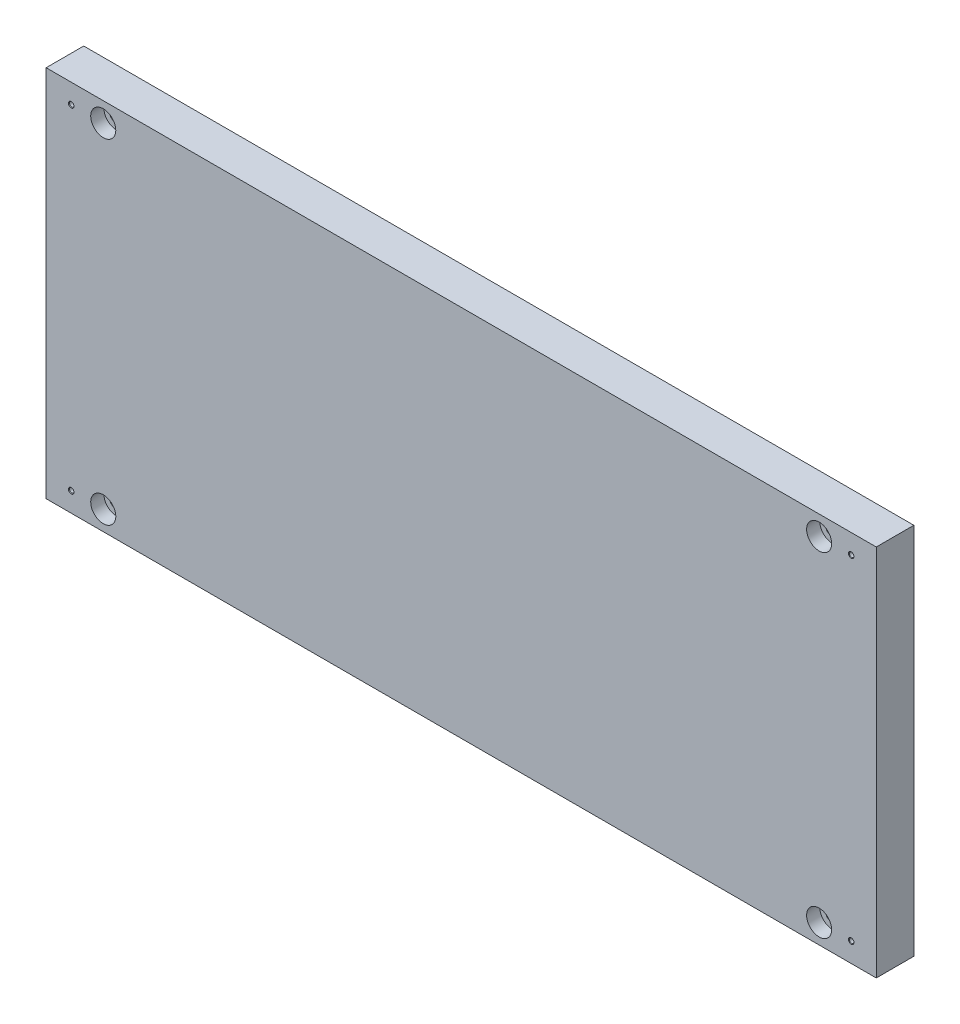
from build123d import *

# Parameters (mm, degrees)
SZKIC1_W                    = 596
SZKIC1_H                    = 268
DODANIE_WYCI_GNI_CIE1_DEPTH = 27
SZKIC2_W                    = 17.5
SZKIC2_H                    = 5
SZKIC3_W                    = 17.5
SZKIC3_H                    = 5
SZKIC4_W                    = 17.5
SZKIC4_H                    = 5
SZKIC5_W                    = 17.5
SZKIC5_H                    = 5
SZKIC6_W                    = 9.5
SZKIC6_H                    = 9
SZKIC7_W                    = 9.5
SZKIC7_H                    = 9
SZKIC8_W                    = 9.5
SZKIC8_H                    = 9
SZKIC9_W                    = 9.5
SZKIC9_H                    = 9


with BuildPart() as part:
    # Szkic1 → Dodanie-wyciągnięcie1 (new body)
    with BuildSketch(Plane.XY):
        Rectangle(SZKIC1_W, SZKIC1_H)
    extrude(amount=DODANIE_WYCI_GNI_CIE1_DEPTH)

    # Szkic2 → Wycięcie-obrót1 (revolve, cut)
    with BuildSketch(Plane(origin=(257, 0, 0), x_dir=(0, 0, -1), z_dir=(1, 0, 0))):
        with Locations((-8.75, 122.5)):
            Rectangle(SZKIC2_W, SZKIC2_H)
    revolve(axis=Axis((257, 120, 0), (0, 0, 1)), mode=Mode.SUBTRACT)

    # Szkic3 → Wycięcie-obrót2 (revolve, cut)
    with BuildSketch(Plane(origin=(257, 0, 0), x_dir=(0, 0, -1), z_dir=(1, 0, 0))):
        with Locations((-8.75, -122.5)):
            Rectangle(SZKIC3_W, SZKIC3_H)
    revolve(axis=Axis((257, -120, 17.5), (0, 0, -1)), mode=Mode.SUBTRACT)

    # Szkic4 → Wycięcie-obrót3 (revolve, cut)
    with BuildSketch(Plane(origin=(-257, 0, 0), x_dir=(0, 0, -1), z_dir=(1, 0, 0))):
        with Locations((-8.75, 122.5)):
            Rectangle(SZKIC4_W, SZKIC4_H)
    revolve(axis=Axis((-257, 120, 0), (0, 0, 1)), mode=Mode.SUBTRACT)

    # Szkic5 → Wycięcie-obrót4 (revolve, cut)
    with BuildSketch(Plane(origin=(-257, 0, 0), x_dir=(0, 0, -1), z_dir=(1, 0, 0))):
        with Locations((-8.75, -122.5)):
            Rectangle(SZKIC5_W, SZKIC5_H)
    revolve(axis=Axis((-257, -120, 17.5), (0, 0, -1)), mode=Mode.SUBTRACT)

    # Szkic6 → Wycięcie-obrót5 (revolve, cut)
    with BuildSketch(Plane(origin=(-257, 0, 0), x_dir=(0, 0, -1), z_dir=(1, 0, 0))):
        with Locations((-22.25, 124.5)):
            Rectangle(SZKIC6_W, SZKIC6_H)
    revolve(axis=Axis((-257, 120, 17.5), (0, 0, 1)), mode=Mode.SUBTRACT)

    # Szkic7 → Wycięcie-obrót6 (revolve, cut)
    with BuildSketch(Plane(origin=(257, 0, 0), x_dir=(0, 0, -1), z_dir=(1, 0, 0))):
        with Locations((-22.25, 124.5)):
            Rectangle(SZKIC7_W, SZKIC7_H)
    revolve(axis=Axis((257, 120, 17.5), (0, 0, 1)), mode=Mode.SUBTRACT)

    # Szkic8 → Wycięcie-obrót7 (revolve, cut)
    with BuildSketch(Plane(origin=(-257, 0, 0), x_dir=(0, 0, -1), z_dir=(1, 0, 0))):
        with Locations((-22.25, -124.5)):
            Rectangle(SZKIC8_W, SZKIC8_H)
    revolve(axis=Axis((-257, -120, 27), (0, 0, -1)), mode=Mode.SUBTRACT)

    # Szkic9 → Wycięcie-obrót8 (revolve, cut)
    with BuildSketch(Plane(origin=(257, 0, 0), x_dir=(0, 0, -1), z_dir=(1, 0, 0))):
        with Locations((-22.25, -124.5)):
            Rectangle(SZKIC9_W, SZKIC9_H)
    revolve(axis=Axis((257, -120, 27), (0, 0, -1)), mode=Mode.SUBTRACT)

    # Szkic10 → Wycięcie-obrót9 (revolve, cut)
    with BuildSketch(Plane(origin=(-280, 0, 0), x_dir=(0, 0, -1), z_dir=(1, 0, 0))):
        Polygon((-27, 120), (-27, 122), (-26.621, 121.621), (-17.281184248, 121.621), (-16.345299462, 120), align=None)
    revolve(axis=Axis((-280, 120, 16.345299462), (0, 0, 1)), mode=Mode.SUBTRACT)

    # Szkic11 → Wycięcie-obrót10 (revolve, cut)
    with BuildSketch(Plane(origin=(-280, 0, 0), x_dir=(0, 0, -1), z_dir=(1, 0, 0))):
        Polygon((-16.345299462, -120), (-17.281184248, -121.621), (-26.621, -121.621), (-27, -122), (-27, -120), align=None)
    revolve(axis=Axis((-280, -120, 27), (0, 0, -1)), mode=Mode.SUBTRACT)

    # Szkic12 → Wycięcie-obrót11 (revolve, cut)
    with BuildSketch(Plane(origin=(280, 0, 0), x_dir=(0, 0, -1), z_dir=(1, 0, 0))):
        Polygon((-27, 120), (-27, 122), (-26.621, 121.621), (-17.281184248, 121.621), (-16.345299462, 120), align=None)
    revolve(axis=Axis((280, 120, 16.345299462), (0, 0, 1)), mode=Mode.SUBTRACT)

    # Szkic13 → Wycięcie-obrót12 (revolve, cut)
    with BuildSketch(Plane(origin=(280, 0, 0), x_dir=(0, 0, -1), z_dir=(1, 0, 0))):
        Polygon((-16.345299462, -120), (-17.281184248, -121.621), (-26.621, -121.621), (-27, -122), (-27, -120), align=None)
    revolve(axis=Axis((280, -120, 27), (0, 0, -1)), mode=Mode.SUBTRACT)


solid = part.part
